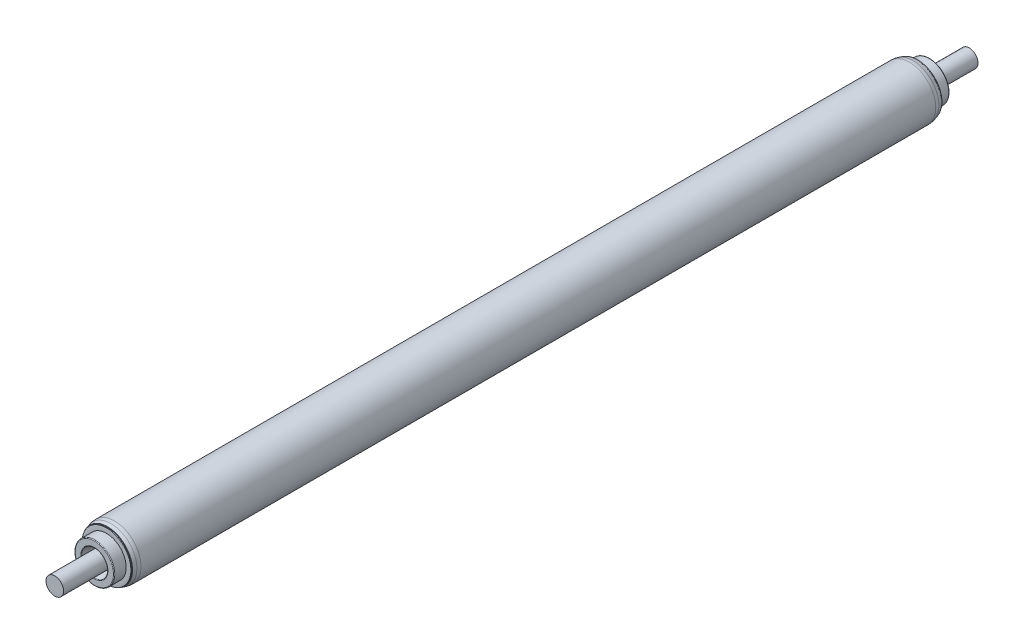
from build123d import *

# Parameters (mm, degrees)
BOSS_EXTRUDE1_DEPTH      = 165.1
BOSS_EXTRUDE1_DEPTH_BACK = 165.1
SKETCH2_R                = 3.175


with BuildPart() as part:
    # Sketch2 → Boss-Extrude1 (new, two sides: drawn at the far end of the back side and taken through both)
    with BuildSketch(Plane.XY.offset(-BOSS_EXTRUDE1_DEPTH_BACK)):
        Circle(SKETCH2_R)
    extrude(amount=BOSS_EXTRUDE1_DEPTH + BOSS_EXTRUDE1_DEPTH_BACK)


with BuildPart() as body_2:
    # Sketch3 → Revolve1 (revolve)
    with BuildSketch(Plane.ZY, mode=Mode.PRIVATE) as revolve1_sk:
        with BuildLine():
            Line((138.1125, 7.14248), (150.5585, 7.14248))
            ThreePointArc((150.5585, 7.14248), (150.738105122, 7.068085122), (150.8125, 6.88848))
            Line((150.8125, 6.88848), (150.8125, 4.915888048))
            ThreePointArc((150.8125, 4.915888048), (150.775549774, 4.783958538), (150.67544964, 4.690413478))
            ThreePointArc((150.67544964, 4.690413478), (147.660046764, 3.559326529), (144.4625, 3.175))
            Line((144.4625, 3.175), (138.1125, 3.175))
            Line((138.1125, 3.175), (138.1125, 7.14248))
        make_face()
    revolve(revolve1_sk.sketch.rotate(Axis((0, 0, 165.1), (0, 0, -1)), 180), axis=Axis((0, 0, 165.1), (0, 0, -1)))


with BuildPart() as body_3:
    # Sketch6 → Revolve4 (revolve)
    with BuildSketch(Plane(origin=(0, 0, 0), x_dir=(0, 0, -1), z_dir=(1, 0, 0)), mode=Mode.PRIVATE) as revolve4_sk:
        with BuildLine():
            Line((-146.05, 9.017), (-144.800124251, 9.351903198))
            ThreePointArc((-144.800124251, 9.351903198), (-144.148396558, 9.481539896), (-143.485323502, 9.525))
            Line((-143.485323502, 9.525), (143.485323502, 9.525))
            ThreePointArc((143.485323502, 9.525), (144.148396558, 9.481539896), (144.800124251, 9.351903198))
            Line((144.800124251, 9.351903198), (146.05, 9.017))
            Line((146.05, 9.017), (146.05, 8.9154))
            Line((146.05, 8.9154), (143.745191069, 8.509))
            Line((143.745191069, 8.509), (-143.745191069, 8.509))
            Line((-143.745191069, 8.509), (-146.05, 8.9154))
            Line((-146.05, 8.9154), (-146.05, 9.017))
        make_face()
    revolve(revolve4_sk.sketch.rotate(Axis((0, 0, 152.4), (0, 0, -1)), 90), axis=Axis((0, 0, 152.4), (0, 0, -1)))


with BuildPart() as body_4:
    # Sketch4 → Revolve2 (revolve)
    with BuildSketch(Plane(origin=(0, 0, 0), x_dir=(0, 0, -1), z_dir=(1, 0, 0)), mode=Mode.PRIVATE) as revolve2_sk:
        with BuildLine():
            Line((-140.0175, 7.722748309), (-140.0175, 7.14248))
            Line((-140.0175, 7.14248), (-141.6939, 7.14248))
            Line((-141.6939, 7.14248), (-141.6939, 7.63146532))
            Line((-141.6939, 7.63146532), (-143.79829012, 8.002526077))
            ThreePointArc((-143.79829012, 8.002526077), (-145.305535454, 7.806512922), (-146.431, 6.784975252))
            ThreePointArc((-146.431, 6.784975252), (-146.4818, 7.800975252), (-146.431, 8.816975252))
            Line((-146.431, 8.816975252), (-146.177, 8.885034347))
            Line((-146.177, 8.885034347), (-146.177, 8.808834347))
            Line((-146.177, 8.808834347), (-140.0175, 7.722748309))
        make_face()
    revolve(revolve2_sk.sketch.rotate(Axis((0, 0, 152.4), (0, 0, -1)), 90), axis=Axis((0, 0, 152.4), (0, 0, -1)))


with BuildPart() as body_5:
    # Sketch5 → Revolve3 (revolve)
    with BuildSketch(Plane(origin=(0, 0, 0), x_dir=(0, 0, -1), z_dir=(1, 0, 0)), mode=Mode.PRIVATE) as revolve3_sk:
        with BuildLine():
            Line((-143.266100111, 6.624260056), (-142.03856116, 7.33298))
            Line((-142.03856116, 7.33298), (-144.06245, 7.33298))
            Line((-144.06245, 7.33298), (-144.497511804, 4.865621902))
            ThreePointArc((-144.497511804, 4.865621902), (-144.076746304, 5.881439679), (-143.266100111, 6.624260056))
        make_face()
    revolve(revolve3_sk.sketch.rotate(Axis((0, 0, 152.4), (0, 0, -1)), 90), axis=Axis((0, 0, 152.4), (0, 0, -1)))


with BuildPart() as body_6:
    # Mirror1: mirrored copy
    add(body_2.part.mirror(Plane.XY))


with BuildPart() as body_7:
    # Mirror1 2: mirrored copy
    add(body_4.part.mirror(Plane.XY))


with BuildPart() as body_8:
    # Mirror1 3: mirrored copy
    add(body_5.part.mirror(Plane.XY))


solid = Compound([part.part, body_2.part, body_3.part, body_4.part, body_5.part, body_6.part, body_7.part, body_8.part])
